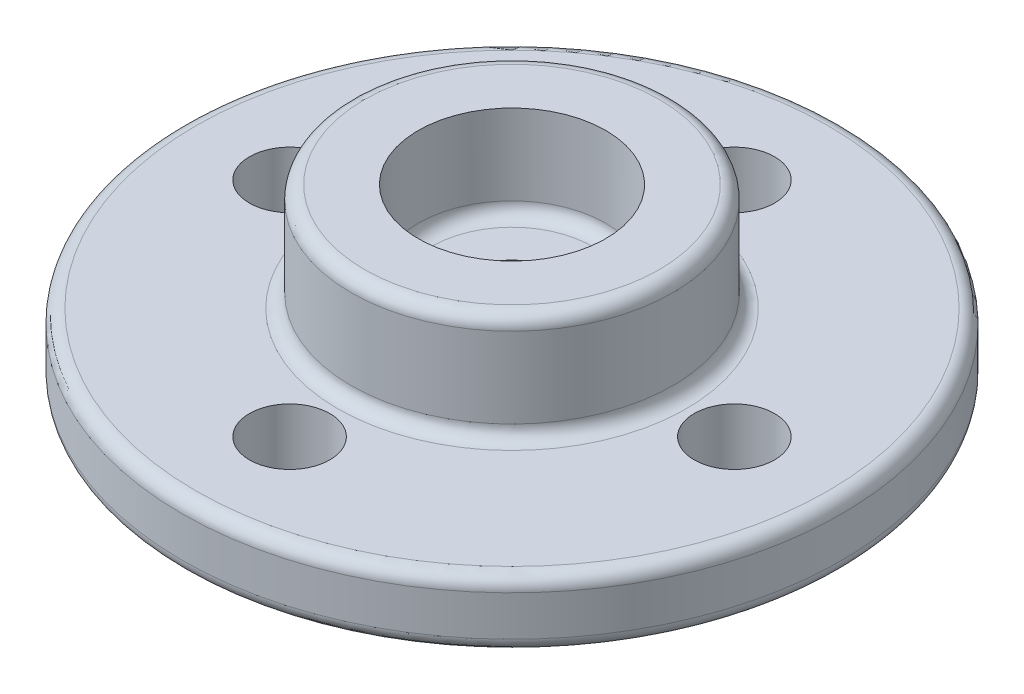
from build123d import *

# Parameters (mm, degrees)
SKETCH2_R          = 1.5
CUT_EXTRUDE1_DEPTH = 10
CIRPATTERN1_COUNT  = 4
FILLET1_R          = 0.5


with BuildPart() as part:
    # Sketch1 → Revolve1 (revolve)
    with BuildSketch(Plane(origin=(0, 0, 0), x_dir=(0, 0, -1), z_dir=(1, 0, 0))):
        Polygon((1.5, 0), (1.5, 3), (3.5, 3), (3.5, 6.5), (6, 6.5), (6, 2.5), (12.3, 2.5), (12.3, 0), align=None)
    revolve(axis=Axis((0, -5.736482489, 0), (0, 1, 0)))

    # Sketch2 → Cut-Extrude1 (cut)
    with BuildSketch(Plane.XZ):
        with Locations(Location((0, -8.3, 0), (0, 0, 270))):
            Circle(SKETCH2_R)
    cut_extrude1 = extrude(amount=-CUT_EXTRUDE1_DEPTH, mode=Mode.SUBTRACT)

    # CirPattern1: Cut-Extrude1 ×4 about axis
    cirpattern1_axis = Axis((0, 0, 0), (0, 1, 0))
    for i in range(1, CIRPATTERN1_COUNT):
        add(cut_extrude1.rotate(cirpattern1_axis, i * 360 / CIRPATTERN1_COUNT), mode=Mode.SUBTRACT)

    # Fillet1
    fillet1_edges = [part.edges().sort_by_distance(p)[0] for p in [
        (0, 0, 12.3),
        (0, 2.5, 12.3),
        (0, 2.5, 6),
        (0, 6.5, 6),
        (0, 3, 3.5),
    ]]
    fillet(fillet1_edges, radius=FILLET1_R)


solid = part.part
